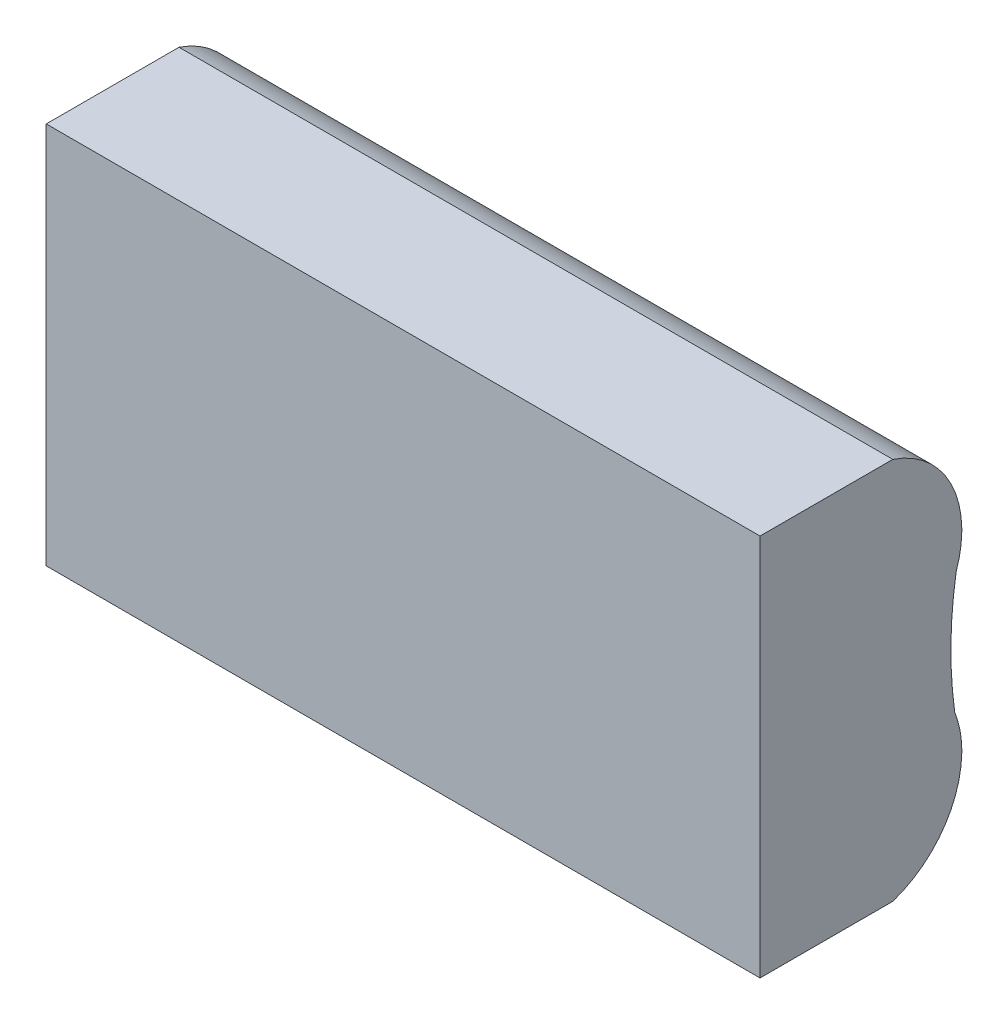
from build123d import *

# Parameters (mm, degrees)
CROQUIS1_W              = 69
CROQUIS1_H              = 37
SALIENTE_EXTRUIR1_DEPTH = 19.5
CORTAR_EXTRUIR3_DEPTH   = 70


with BuildPart() as part:
    # Croquis1 → Saliente-Extruir1 (new body)
    with BuildSketch(Plane.XY):
        Rectangle(CROQUIS1_W, CROQUIS1_H)
    extrude(amount=SALIENTE_EXTRUIR1_DEPTH)

    # Croquis2 → Cortar-Extruir3 (cut)
    with BuildSketch(Plane(origin=(34.5, 0, 0), x_dir=(0, 0, -1), z_dir=(1, 0, 0))):
        with BuildLine():
            Line((0, 18.5), (-6.665805067, 18.5))
            ThreePointArc((-6.665805067, 18.5), (-1.896690737, 15.030939451), (0, 9.446908932))
            Line((0, 9.446908932), (0, 18.5))
        make_face()
        with BuildLine():
            Line((0, -9.053091068), (0, 9.053090641))
            ThreePointArc((0, 9.053090641), (-0.150040841, 7.534931091), (-0.535059254, 6.058759862))
            ThreePointArc((-0.535059254, 6.058759862), (-1.05, 0.19825397), (-0.677845098, -5.673048612))
            ThreePointArc((-0.677845098, -5.673048612), (-0.18835007, -7.332873528), (0, -9.053091068))
        make_face()
        with BuildLine():
            ThreePointArc((0, -9.446909359), (-1.896690336, -15.030939334), (-6.665803784, -18.5))
            Line((-6.665803784, -18.5), (0, -18.5))
            Line((0, -18.5), (0, -9.446909359))
        make_face()
    extrude(amount=-CORTAR_EXTRUIR3_DEPTH, mode=Mode.SUBTRACT)


solid = part.part
